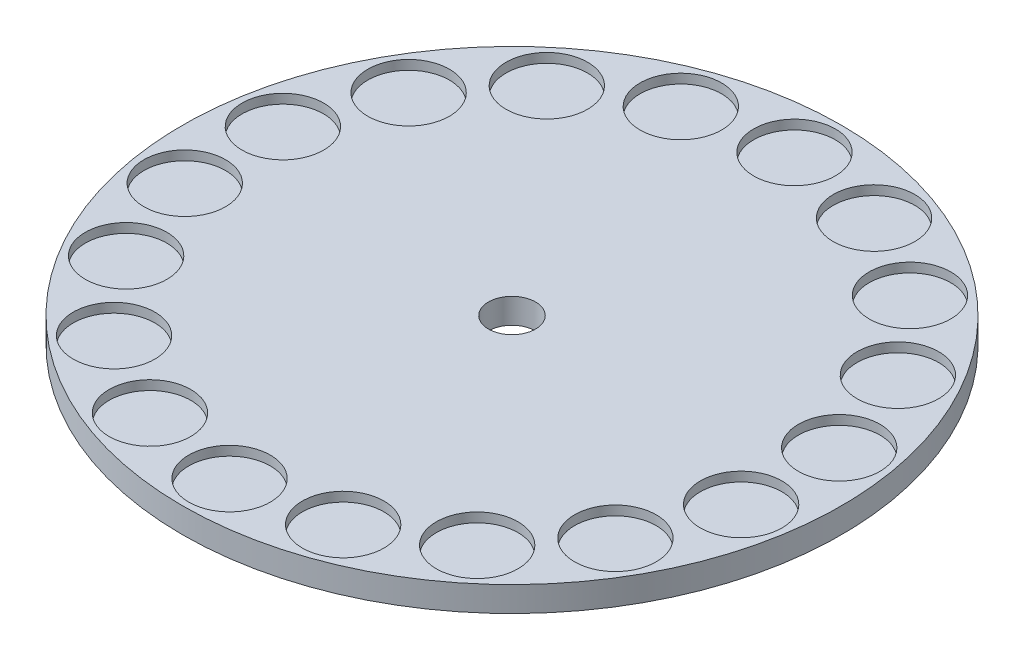
from build123d import *

# Parameters (mm, degrees)
SKETCH2_R           = 105
SKETCH2_R_2         = 7.5
SKETCH2_R_3         = 13
BOSS_EXTRUDE1_DEPTH = 4
SKETCH1_R           = 105
SKETCH1_R_2         = 7.5
BOSS_EXTRUDE2_DEPTH = 1


with BuildPart() as part:
    # Sketch2 → Boss-Extrude1 (new, symmetric)
    with BuildSketch(Plane(origin=(0, 0, 0), x_dir=(1, 0, 0), z_dir=(0, 1, 0))):
        with Locations(Location((0, 0, 0), (0, 0, 270))):
            Circle(SKETCH2_R)
        with Locations(Location((0, 0, 0), (0, 0, 270))):
            Circle(SKETCH2_R_2, mode=Mode.SUBTRACT)
        with Locations(Location((0, 90, 0), (0, 0, 270))):
            Circle(SKETCH2_R_3, mode=Mode.SUBTRACT)
        with Locations(Location((30.781812899, 84.572335871, 0), (0, 0, 270))):
            Circle(SKETCH2_R_3, mode=Mode.SUBTRACT)
        with Locations(Location((57.850884872, 68.943999881, 0), (0, 0, 270))):
            Circle(SKETCH2_R_3, mode=Mode.SUBTRACT)
        with Locations(Location((77.942286341, 45, 0), (0, 0, 270))):
            Circle(SKETCH2_R_3, mode=Mode.SUBTRACT)
        with Locations(Location((88.632697771, 15.62833599, 0), (0, 0, 270))):
            Circle(SKETCH2_R_3, mode=Mode.SUBTRACT)
        with Locations(Location((88.632697771, -15.62833599, 0), (0, 0, 270))):
            Circle(SKETCH2_R_3, mode=Mode.SUBTRACT)
        with Locations(Location((77.942286341, -45, 0), (0, 0, 270))):
            Circle(SKETCH2_R_3, mode=Mode.SUBTRACT)
        with Locations(Location((57.850884872, -68.943999881, 0), (0, 0, 270))):
            Circle(SKETCH2_R_3, mode=Mode.SUBTRACT)
        with Locations(Location((30.781812899, -84.572335871, 0), (0, 0, 270))):
            Circle(SKETCH2_R_3, mode=Mode.SUBTRACT)
        with Locations(Location((0, -90, 0), (0, 0, 270))):
            Circle(SKETCH2_R_3, mode=Mode.SUBTRACT)
        with Locations(Location((-30.781812899, -84.572335871, 0), (0, 0, 270))):
            Circle(SKETCH2_R_3, mode=Mode.SUBTRACT)
        with Locations(Location((-57.850884872, -68.943999881, 0), (0, 0, 270))):
            Circle(SKETCH2_R_3, mode=Mode.SUBTRACT)
        with Locations(Location((-77.942286341, -45, 0), (0, 0, 270))):
            Circle(SKETCH2_R_3, mode=Mode.SUBTRACT)
        with Locations(Location((-88.632697771, -15.62833599, 0), (0, 0, 270))):
            Circle(SKETCH2_R_3, mode=Mode.SUBTRACT)
        with Locations(Location((-88.632697771, 15.62833599, 0), (0, 0, 270))):
            Circle(SKETCH2_R_3, mode=Mode.SUBTRACT)
        with Locations(Location((-77.942286341, 45, 0), (0, 0, 270))):
            Circle(SKETCH2_R_3, mode=Mode.SUBTRACT)
        with Locations(Location((-57.850884872, 68.943999881, 0), (0, 0, 270))):
            Circle(SKETCH2_R_3, mode=Mode.SUBTRACT)
        with Locations(Location((-30.781812899, 84.572335871, 0), (0, 0, 270))):
            Circle(SKETCH2_R_3, mode=Mode.SUBTRACT)
    extrude(amount=BOSS_EXTRUDE1_DEPTH, both=True)

    # Sketch1 → Boss-Extrude2 (add, symmetric)
    with BuildSketch(Plane(origin=(0, 0, 0), x_dir=(1, 0, 0), z_dir=(0, 1, 0))):
        with Locations(Location((0, 0, 0), (0, 0, 270))):
            Circle(SKETCH1_R)
        with Locations(Location((0, 0, 0), (0, 0, 270))):
            Circle(SKETCH1_R_2, mode=Mode.SUBTRACT)
    extrude(amount=BOSS_EXTRUDE2_DEPTH, both=True)


solid = part.part
